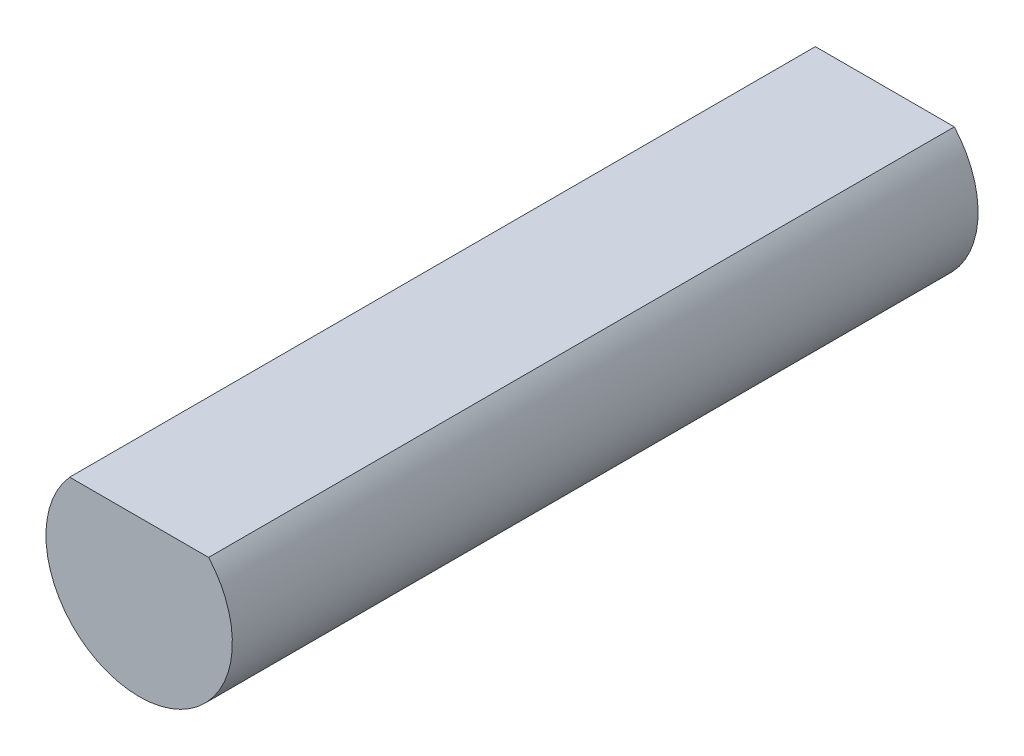
from build123d import *

# Parameters (mm, degrees)
EXTRUDE_1_DEPTH = 12


with BuildPart() as part:
    # 草图1 → 凸台-拉伸1 (new body)
    with BuildSketch(Plane.XY):
        with BuildLine():
            Line((-1.118033989, 1), (1.118033989, 1))
            ThreePointArc((1.118033989, 1), (0, -1.5), (-1.118033989, 1))
        make_face()
    extrude(amount=EXTRUDE_1_DEPTH)


solid = part.part
